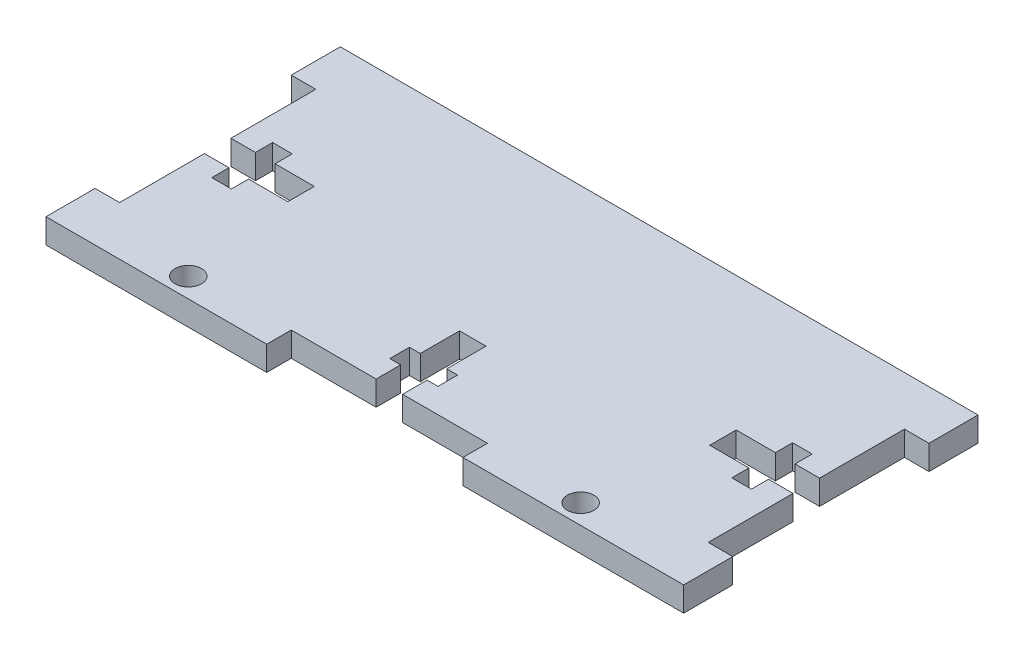
from build123d import *

# Parameters (mm, degrees)
SKETCH1_R           = 1.7145
BOSS_EXTRUDE1_DEPTH = 3.175


with BuildPart() as part:
    # Sketch1 → Boss-Extrude1 (new body)
    with BuildSketch(Plane(origin=(0, 0, 0), x_dir=(1, 0, 0), z_dir=(0, 1, 0))):
        Polygon((-12.7, -3.175), (-12.7, 0), (-1.7145, 0), (-1.7145, 3.175), (-3.120656915, 3.175), (-3.120656915, 5.715), (-1.7145, 5.715), (-1.7145, 10.795), (1.7145, 10.795), (1.7145, 5.715), (3.120656915, 5.715), (3.120656915, 3.175), (1.7145, 3.175), (1.7145, 0), (12.7, 0), (12.7, -3.175), (41.275, -3.175), (41.275, 3.175), (38.1, 3.175), (38.1, 14.1605), (34.925, 14.1605), (34.925, 11.938), (32.385, 11.938), (32.385, 14.1605), (27.305, 14.1605), (27.305, 17.5895), (32.385, 17.5895), (32.385, 19.812), (34.925, 19.812), (34.925, 17.5895), (38.1, 17.5895), (38.1, 28.575), (41.275, 28.575), (41.275, 34.925), (-41.275, 34.925), (-41.275, 28.575), (-38.1, 28.575), (-38.1, 17.5895), (-34.925, 17.5895), (-34.925, 19.812), (-32.385, 19.812), (-32.385, 17.5895), (-27.305, 17.5895), (-27.305, 14.1605), (-32.385, 14.1605), (-32.385, 11.938), (-34.925, 11.938), (-34.925, 14.1605), (-38.1, 14.1605), (-38.1, 3.175), (-41.275, 3.175), (-41.275, -3.175), align=None)
        with Locations(Location((-25.4, -0.635, 0), (0, 0, 270))):
            Circle(SKETCH1_R, mode=Mode.SUBTRACT)
        with Locations(Location((25.4, -0.635, 0), (0, 0, 270))):
            Circle(SKETCH1_R, mode=Mode.SUBTRACT)
    extrude(amount=BOSS_EXTRUDE1_DEPTH)


solid = part.part
